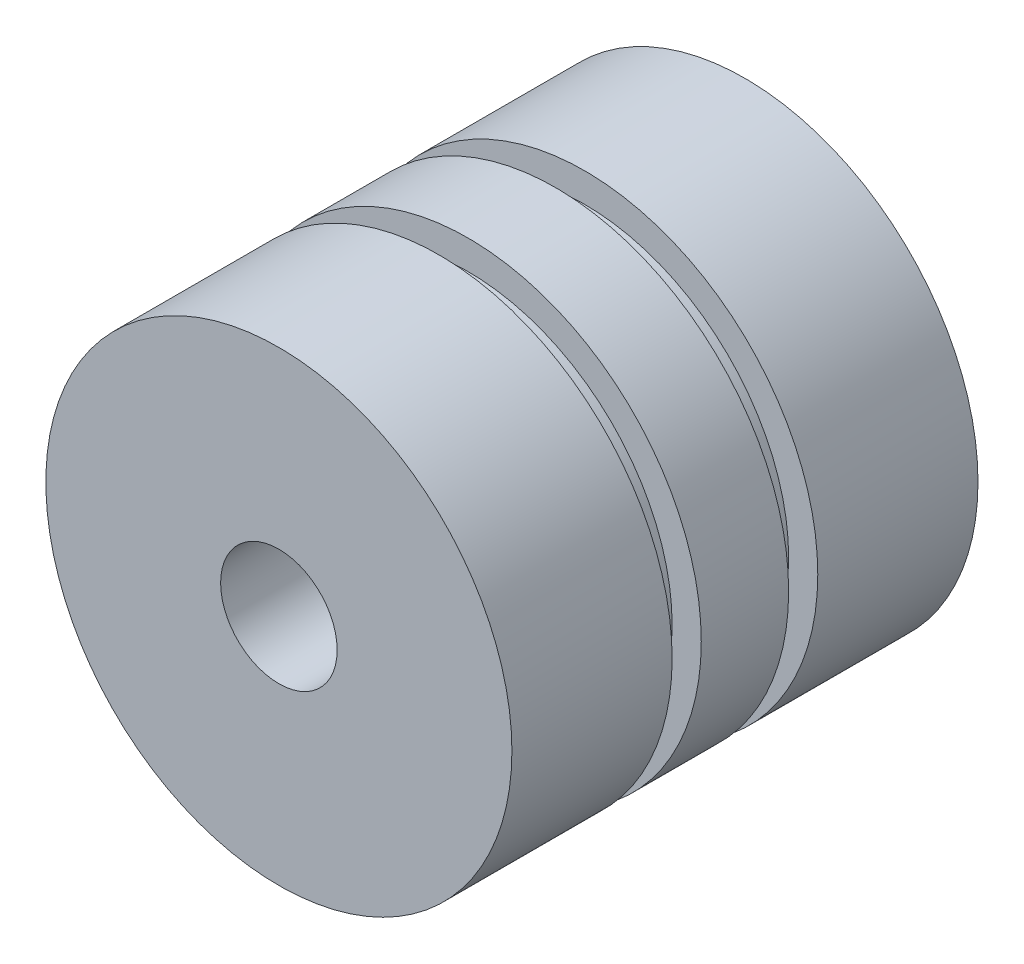
from build123d import *

# Parameters (mm, degrees)
SKETCH_1_R          = 16
SKETCH_1_R_2        = 4
EXTRUDE_1_DEPTH     = 16
CUT_EXTRUDE_START   = 5
SKETCH_2_R          = 16
SKETCH_2_R_2        = 14
CUT_EXTRUDE_1_DEPTH = 2
CUT_EXTRUDE_START_2 = -3
SKETCH_2_2_R        = 16
SKETCH_2_2_R_2      = 14
CUT_EXTRUDE_2_DEPTH = 2
SKETCH_4_R          = 5.45
CUT_EXTRUDE_4_DEPTH = 10


with BuildPart() as part:
    # 스케치1 → 보스-돌출1 (new, symmetric)
    with BuildSketch(Plane.XY):
        Circle(SKETCH_1_R)
        Circle(SKETCH_1_R_2, mode=Mode.SUBTRACT)
    extrude(amount=EXTRUDE_1_DEPTH, both=True)

    # 스케치2 → 컷-돌출1 (cut)
    with BuildSketch(Plane.XY.offset(CUT_EXTRUDE_START)):
        Circle(SKETCH_2_R)
        Circle(SKETCH_2_R_2, mode=Mode.SUBTRACT)
    extrude(amount=-CUT_EXTRUDE_1_DEPTH, mode=Mode.SUBTRACT)

    # 스케치2<2> → 컷-돌출2 (cut)
    with BuildSketch(Plane.XY.offset(CUT_EXTRUDE_START_2)):
        Circle(SKETCH_2_2_R)
        Circle(SKETCH_2_2_R_2, mode=Mode.SUBTRACT)
    extrude(amount=-CUT_EXTRUDE_2_DEPTH, mode=Mode.SUBTRACT)

    # 스케치4 → 컷-돌출4 (cut)
    with BuildSketch(Plane(origin=(0, 0, -16), x_dir=(-1, 0, 0), z_dir=(0, 0, -1))):
        Circle(SKETCH_4_R)
    extrude(amount=-CUT_EXTRUDE_4_DEPTH, mode=Mode.SUBTRACT)


solid = part.part
